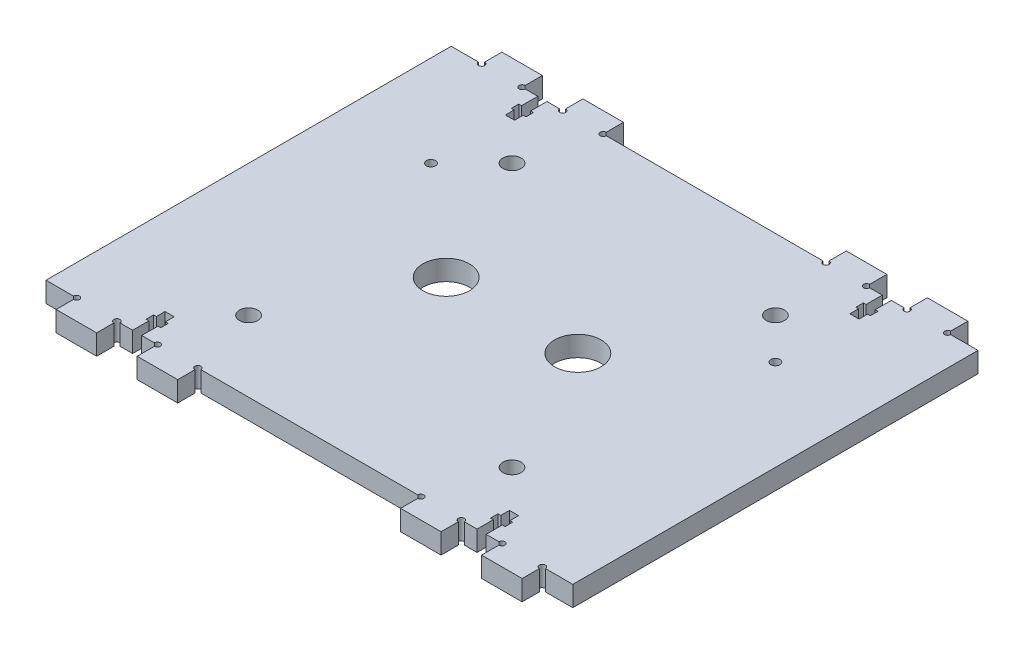
from build123d import *

# Parameters (mm, degrees)
SKETCH1_W            = 260
SKETCH1_H            = 200
EXTRUDE1_DEPTH       = 10
M4_CLEARANCE_HOLE1_D = 4.5
SKETCH7_W            = 20
SKETCH7_H            = 10
EXTRUDE4_DEPTH       = 10
LPATTERN1_COUNT      = 2
LPATTERN1_PITCH      = 170
LPATTERN1_COUNT_DIR2 = 2
LPATTERN1_PITCH_DIR2 = 210
EXTRUDE5_DEPTH       = 10
MIRROR5_COPY_1_DEPTH = 10
EXTRUDE6_DEPTH       = 10
MIRROR7_COPY_1_DEPTH = 10
SKETCH10_R           = 11.5
EXTRUDE7_DEPTH       = 10
M8_CLEARANCE_HOLE1_D = 9


with BuildPart() as part:
    # Sketch1 → Extrude1 (new body)
    with BuildSketch(Plane(origin=(0, 0, 0), x_dir=(1, 0, 0), z_dir=(0, 1, 0))):
        Rectangle(SKETCH1_W, SKETCH1_H)
    extrude(amount=EXTRUDE1_DEPTH)

    # M4 Clearance Hole1 (through all)
    with Locations(Plane(origin=(0, 10, 0), x_dir=(1, 0, 0), z_dir=(0, 1, 0))):
        with Locations((-85, 45), (85, 45)):
            Hole(M4_CLEARANCE_HOLE1_D / 2)

    # Sketch7 → Extrude4 (add)
    with BuildSketch(Plane(origin=(0, 10, 0), x_dir=(1, 0, 0), z_dir=(0, 1, 0))):
        with Locations((-105, -105)):
            Rectangle(SKETCH7_W, SKETCH7_H)
        with Locations((-65, -105)):
            Rectangle(SKETCH7_W, SKETCH7_H)
    extrude4 = extrude(amount=-EXTRUDE4_DEPTH)

    # LPattern1: Extrude4 2 × 2
    with Locations(*[(i * LPATTERN1_PITCH, 0, -j * LPATTERN1_PITCH_DIR2) for i in range(LPATTERN1_COUNT) for j in range(LPATTERN1_COUNT_DIR2) if (i, j) != (0, 0)]):
        add(extrude4)

    # Sketch8 → Extrude5 (cut)
    with BuildSketch(Plane(origin=(0, 10, 0), x_dir=(1, 0, 0), z_dir=(0, 1, 0))):
        with BuildLine():
            Line((-116.5, -100), (-115, -100))
            Line((-115, -100), (-115, -101.5))
            ThreePointArc((-115, -101.5), (-113.939339828, -98.939339828), (-116.5, -100))
        make_face()
        with BuildLine():
            Line((-95, -101.5), (-95, -100))
            Line((-95, -100), (-93.5, -100))
            ThreePointArc((-93.5, -100), (-96.060660172, -98.939339828), (-95, -101.5))
        make_face()
        with BuildLine():
            Line((-75, -100), (-75, -101.5))
            ThreePointArc((-75, -101.5), (-73.939339828, -98.939339828), (-76.5, -100))
            Line((-76.5, -100), (-75, -100))
        make_face()
        with BuildLine():
            Line((-55, -101.5), (-55, -100))
            Line((-55, -100), (-53.5, -100))
            ThreePointArc((-53.5, -100), (-56.060660172, -98.939339828), (-55, -101.5))
        make_face()
    extrude5 = extrude(amount=-EXTRUDE5_DEPTH, mode=Mode.SUBTRACT)

    # Mirror4: Extrude5 across plane
    add(extrude5.mirror(Plane(origin=(0, 0, 0), x_dir=(0, 0, 1), z_dir=(1, 0, 0))), mode=Mode.SUBTRACT)

    # Mirror5: Extrude5 across plane
    add(extrude5.mirror(Plane.XY), mode=Mode.SUBTRACT)

    # Mirror5 copy 1 sketch → Mirror5 copy 1 (cut)
    with BuildSketch(Plane(origin=(0, 10, 0), x_dir=(-1, 0, 0), z_dir=(0, 1, 0))):
        with BuildLine():
            Line((-116.5, -100), (-115, -100))
            Line((-115, -100), (-115, -101.5))
            ThreePointArc((-115, -101.5), (-113.939339828, -98.939339828), (-116.5, -100))
        make_face()
        with BuildLine():
            Line((-95, -101.5), (-95, -100))
            Line((-95, -100), (-93.5, -100))
            ThreePointArc((-93.5, -100), (-96.060660172, -98.939339828), (-95, -101.5))
        make_face()
        with BuildLine():
            Line((-75, -100), (-75, -101.5))
            ThreePointArc((-75, -101.5), (-73.939339828, -98.939339828), (-76.5, -100))
            Line((-76.5, -100), (-75, -100))
        make_face()
        with BuildLine():
            Line((-55, -101.5), (-55, -100))
            Line((-55, -100), (-53.5, -100))
            ThreePointArc((-53.5, -100), (-56.060660172, -98.939339828), (-55, -101.5))
        make_face()
    extrude(amount=-MIRROR5_COPY_1_DEPTH, mode=Mode.SUBTRACT)

    # Sketch9 → Extrude6 (cut)
    with BuildSketch(Plane(origin=(0, 10, 0), x_dir=(1, 0, 0), z_dir=(0, 1, 0))):
        Polygon((-87.25, -100), (-87.25, -92), (-88.625, -92), (-88.625, -88.3), (-87.25, -88.3), (-87.25, -84), (-82.75, -84), (-82.75, -88.3), (-81.375, -88.3), (-81.375, -92), (-82.75, -92), (-82.75, -100), align=None)
    extrude6 = extrude(amount=-EXTRUDE6_DEPTH, mode=Mode.SUBTRACT)

    # Mirror6: Extrude6 across plane
    add(extrude6.mirror(Plane(origin=(0, 0, 0), x_dir=(0, 0, 1), z_dir=(1, 0, 0))), mode=Mode.SUBTRACT)

    # Mirror7: Extrude6 across plane
    add(extrude6.mirror(Plane.XY), mode=Mode.SUBTRACT)

    # Mirror7 copy 1 sketch → Mirror7 copy 1 (cut)
    with BuildSketch(Plane(origin=(0, 10, 0), x_dir=(-1, 0, 0), z_dir=(0, 1, 0))):
        Polygon((-87.25, -100), (-87.25, -92), (-88.625, -92), (-88.625, -88.3), (-87.25, -88.3), (-87.25, -84), (-82.75, -84), (-82.75, -88.3), (-81.375, -88.3), (-81.375, -92), (-82.75, -92), (-82.75, -100), align=None)
    extrude(amount=-MIRROR7_COPY_1_DEPTH, mode=Mode.SUBTRACT)

    # Sketch10 → Extrude7 (cut)
    with BuildSketch(Plane(origin=(0, 10, 0), x_dir=(1, 0, 0), z_dir=(0, 1, 0))):
        with Locations(Location((-32.5, 0, 0), (0, 0, 270))):
            Circle(SKETCH10_R)
        with Locations(Location((32.5, 0, 0), (0, 0, 270))):
            Circle(SKETCH10_R)
    extrude(amount=-EXTRUDE7_DEPTH, mode=Mode.SUBTRACT)

    # M8 Clearance Hole1 (through all)
    with Locations(Plane(origin=(0, 10, 0), x_dir=(1, 0, 0), z_dir=(0, 1, 0))):
        with Locations((-65, 65), (65, 65), (65, -65), (-65, -65)):
            Hole(M8_CLEARANCE_HOLE1_D / 2)


solid = part.part
